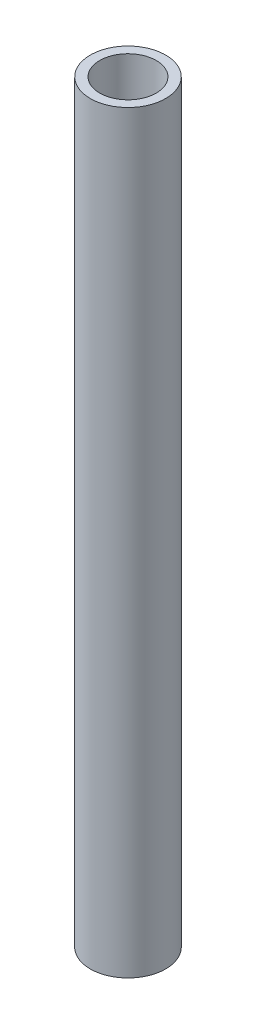
from build123d import *

# Parameters (mm, degrees)
ESQUISSE1_R        = 2
ESQUISSE1_R_2      = 1.5
BOSS_EXTRU_1_DEPTH = 40


with BuildPart() as part:
    # Esquisse1 → Boss.-Extru.1 (new body)
    with BuildSketch(Plane(origin=(0, 0, 0), x_dir=(1, 0, 0), z_dir=(0, 1, 0))):
        with Locations(Location((0, 0, 0), (0, 0, 270))):
            Circle(ESQUISSE1_R)
        with Locations(Location((0, 0, 0), (0, 0, 270))):
            Circle(ESQUISSE1_R_2, mode=Mode.SUBTRACT)
    extrude(amount=BOSS_EXTRU_1_DEPTH)


solid = part.part
